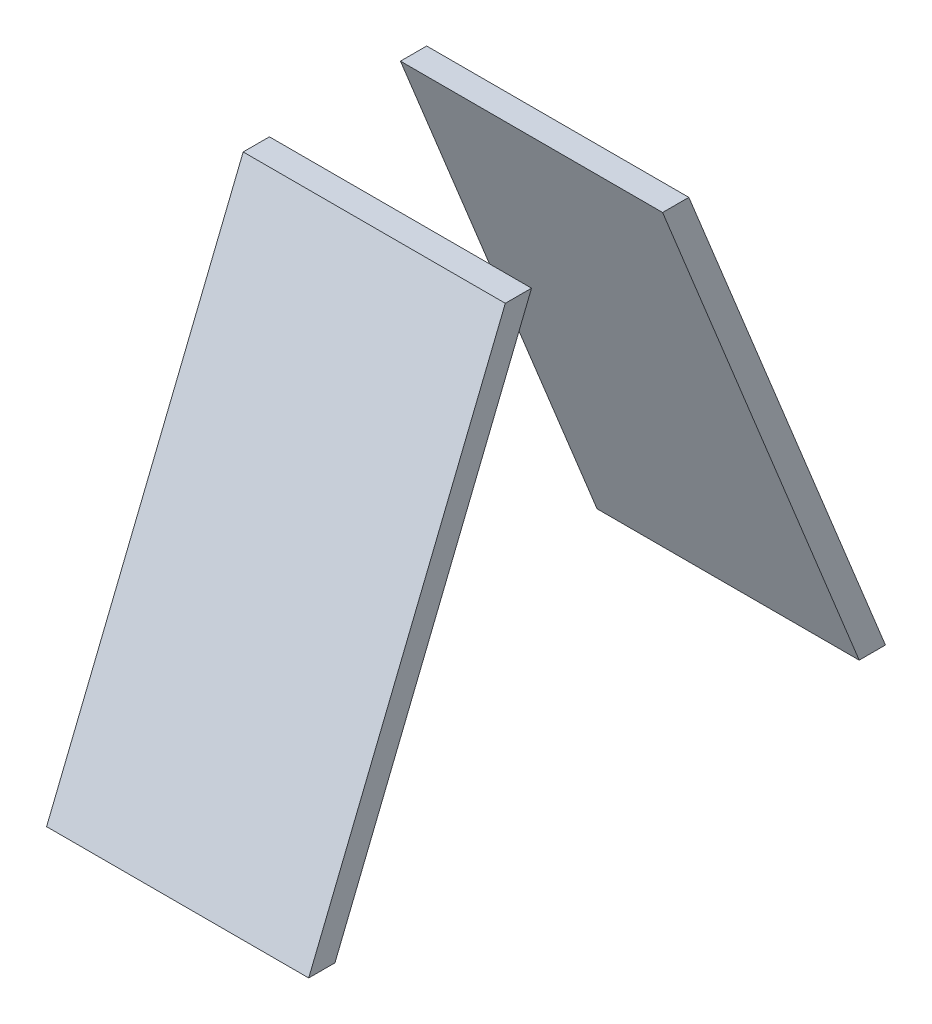
from build123d import *

# Parameters (mm, degrees)
BOSS_EXTRUDE1_DEPTH   = 100
BOSS_EXTRUDE1_2_DEPTH = 100


with BuildPart() as part:
    # Sketch1 → Boss-Extrude1 (new body)
    with BuildSketch(Plane(origin=(0, 0, 0), x_dir=(0, 0, -1), z_dir=(1, 0, 0))):
        Polygon((-25, 50), (-100, -135.404962177), (-110, -135.404962177), (-35, 50), align=None)
    extrude(amount=BOSS_EXTRUDE1_DEPTH)


with BuildPart() as body_2:
    # Sketch1 → Boss-Extrude1 2 (new body)
    with BuildSketch(Plane(origin=(0, 0, 0), x_dir=(0, 0, -1), z_dir=(1, 0, 0))):
        Polygon((110, -135.404962177), (100, -135.404962177), (25, 50), (35, 50), align=None)
    extrude(amount=BOSS_EXTRUDE1_2_DEPTH)


solid = Compound([part.part, body_2.part])
